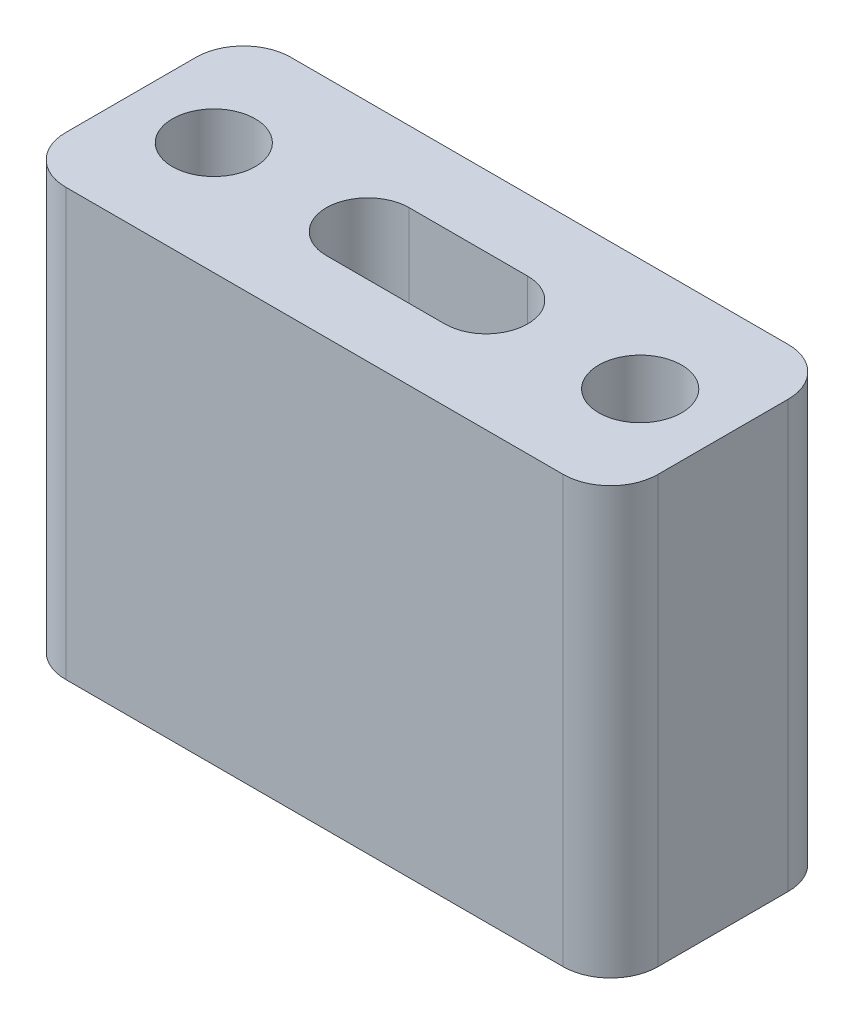
from build123d import *

# Parameters (mm, degrees)
SKETCH_1_W      = 25
SKETCH_1_H      = 9.5
SKETCH_1_R      = 1.75
EXTRUDE_1_DEPTH = 18
FILLET_1_R      = 2


with BuildPart() as part:
    # 草图1 → 凸台-拉伸1 (new body)
    with BuildSketch(Plane(origin=(0, 0, 0), x_dir=(1, 0, 0), z_dir=(0, 1, 0))):
        Rectangle(SKETCH_1_W, SKETCH_1_H)
        with Locations(Location((-9, 0, 0), (0, 0, 270))):
            Circle(SKETCH_1_R, mode=Mode.SUBTRACT)
        with Locations(Location((9, 0, 0), (0, 0, 270))):
            Circle(SKETCH_1_R, mode=Mode.SUBTRACT)
        with BuildLine():
            Line((-2.5, 1.75), (2.5, 1.75))
            ThreePointArc((2.5, 1.75), (4.25, 0), (2.5, -1.75))
            Line((2.5, -1.75), (-2.5, -1.75))
            ThreePointArc((-2.5, -1.75), (-4.25, 0), (-2.5, 1.75))
        make_face(mode=Mode.SUBTRACT)
    extrude(amount=EXTRUDE_1_DEPTH)

    # 圆角1
    fillet_1_edges = [part.edges().sort_by_distance(p)[0] for p in [
        (12.5, 9, 4.75),
        (-12.5, 9, 4.75),
        (-12.5, 9, -4.75),
        (12.5, 9, -4.75),
    ]]
    fillet(fillet_1_edges, radius=FILLET_1_R)


solid = part.part
